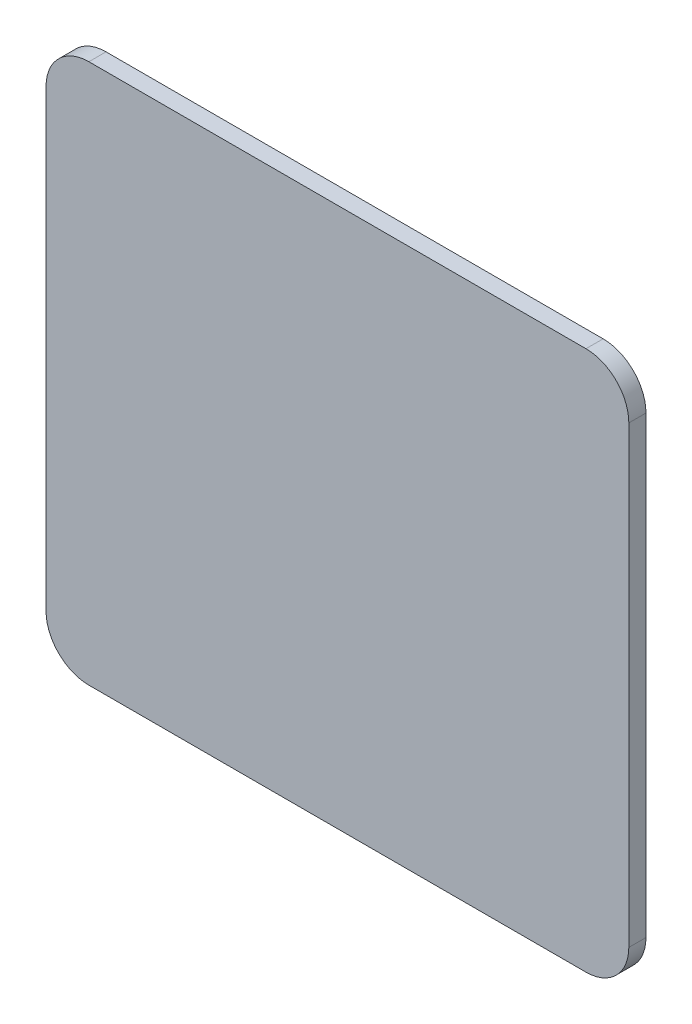
from build123d import *

# Parameters (mm, degrees)
BOSS_EXTRUDE1_DEPTH = 1


with BuildPart() as part:
    # Sketch1 → Boss-Extrude1 (new body)
    with BuildSketch(Plane.XY):
        with BuildLine():
            Line((-9.746478873, 16.940140845), (19.253521127, 16.940140845))
            ThreePointArc((19.253521127, 16.940140845), (21.02128808, 16.207907798), (21.753521127, 14.440140845))
            Line((21.753521127, 14.440140845), (21.753521127, -12.059859155))
            ThreePointArc((21.753521127, -12.059859155), (21.02128808, -13.827626108), (19.253521127, -14.559859155))
            Line((19.253521127, -14.559859155), (-9.746478873, -14.559859155))
            ThreePointArc((-9.746478873, -14.559859155), (-11.514245826, -13.827626108), (-12.246478873, -12.059859155))
            Line((-12.246478873, -12.059859155), (-12.246478873, 14.440140845))
            ThreePointArc((-12.246478873, 14.440140845), (-11.514245826, 16.207907798), (-9.746478873, 16.940140845))
        make_face()
    extrude(amount=BOSS_EXTRUDE1_DEPTH)


solid = part.part
